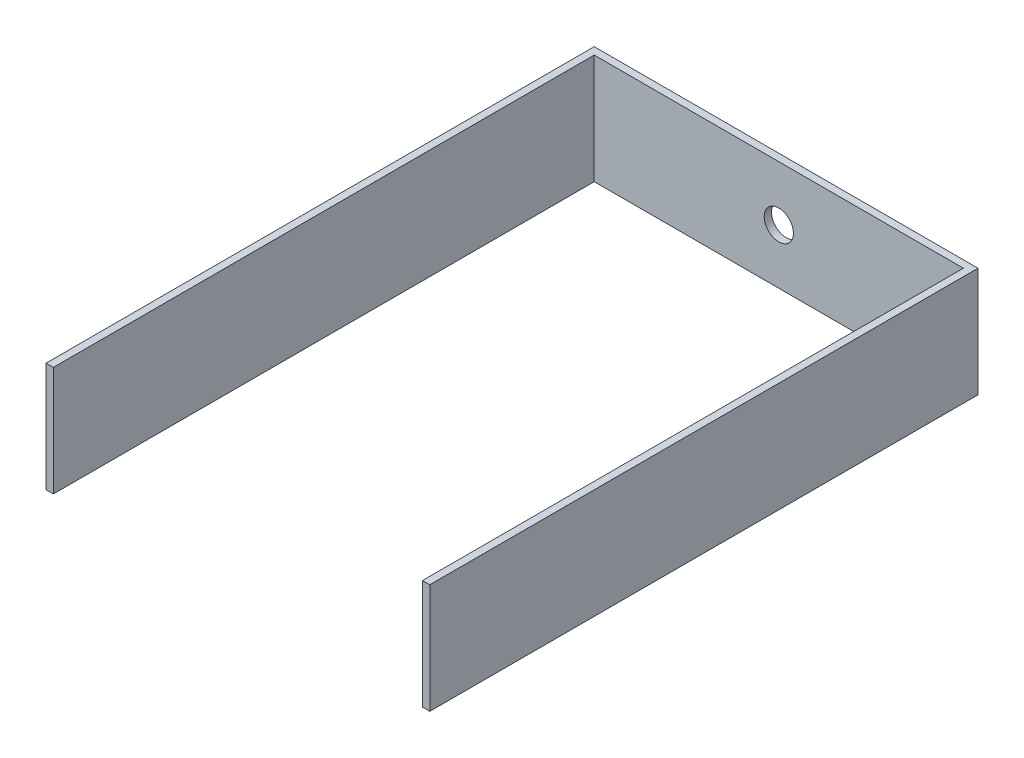
from build123d import *

# Parameters (mm, degrees)
BOSS_EXTRUDE1_DEPTH = 15
SKETCH2_R           = 4
CUT_EXTRUDE1_DEPTH  = 160.628474903


with BuildPart() as part:
    # Sketch1 → Boss-Extrude1 (new, symmetric)
    with BuildSketch(Plane(origin=(0, 0, 0), x_dir=(1, 0, 0), z_dir=(0, 1, 0))):
        Polygon((50.5, -2), (50.5, -150), (52.5, -150), (52.5, 0), (-52.5, 0), (-52.5, -150), (-50.5, -150), (-50.5, -2), align=None)
    extrude(amount=BOSS_EXTRUDE1_DEPTH, both=True)

    # Sketch2 → Cut-Extrude1 (cut, through all)
    with BuildSketch(Plane(origin=(0, 0, 0), x_dir=(-1, 0, 0), z_dir=(0, 0, -1))):
        Circle(SKETCH2_R)
    extrude(amount=-CUT_EXTRUDE1_DEPTH, mode=Mode.SUBTRACT)


solid = part.part
